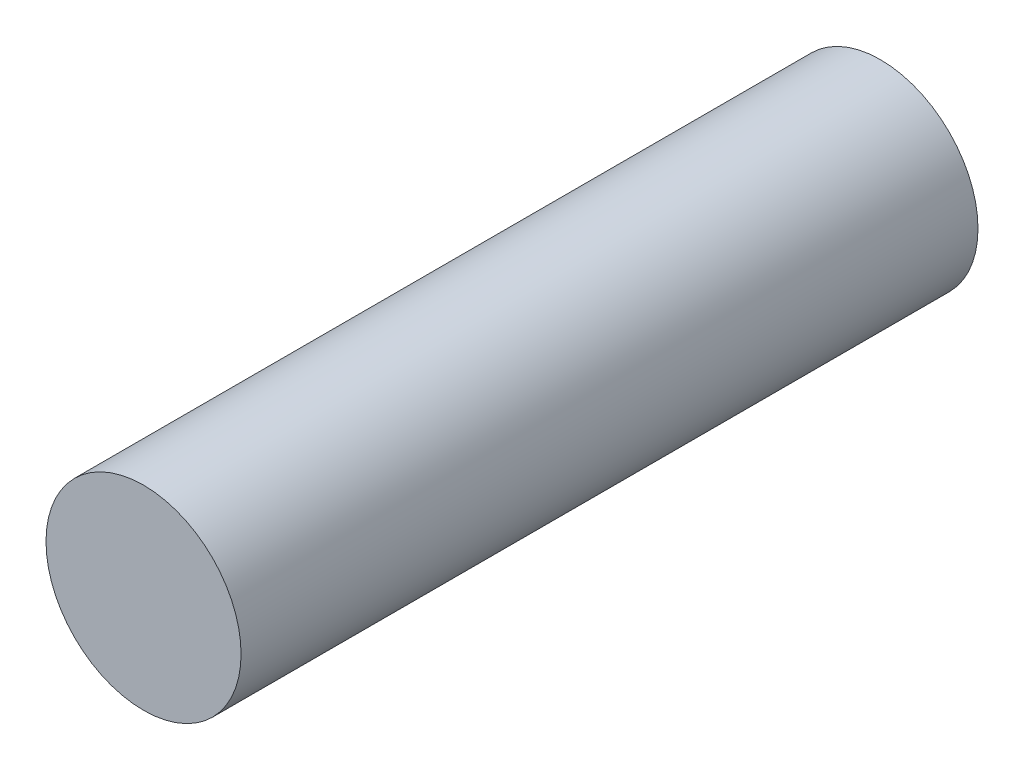
from build123d import *

# Parameters (mm, degrees)
SKETCH1_R           = 2.25
BOSS_EXTRUDE1_DEPTH = 17


with BuildPart() as part:
    # Sketch1 → Boss-Extrude1 (new body)
    with BuildSketch(Plane.XY):
        Circle(SKETCH1_R)
    extrude(amount=BOSS_EXTRUDE1_DEPTH)


solid = part.part
